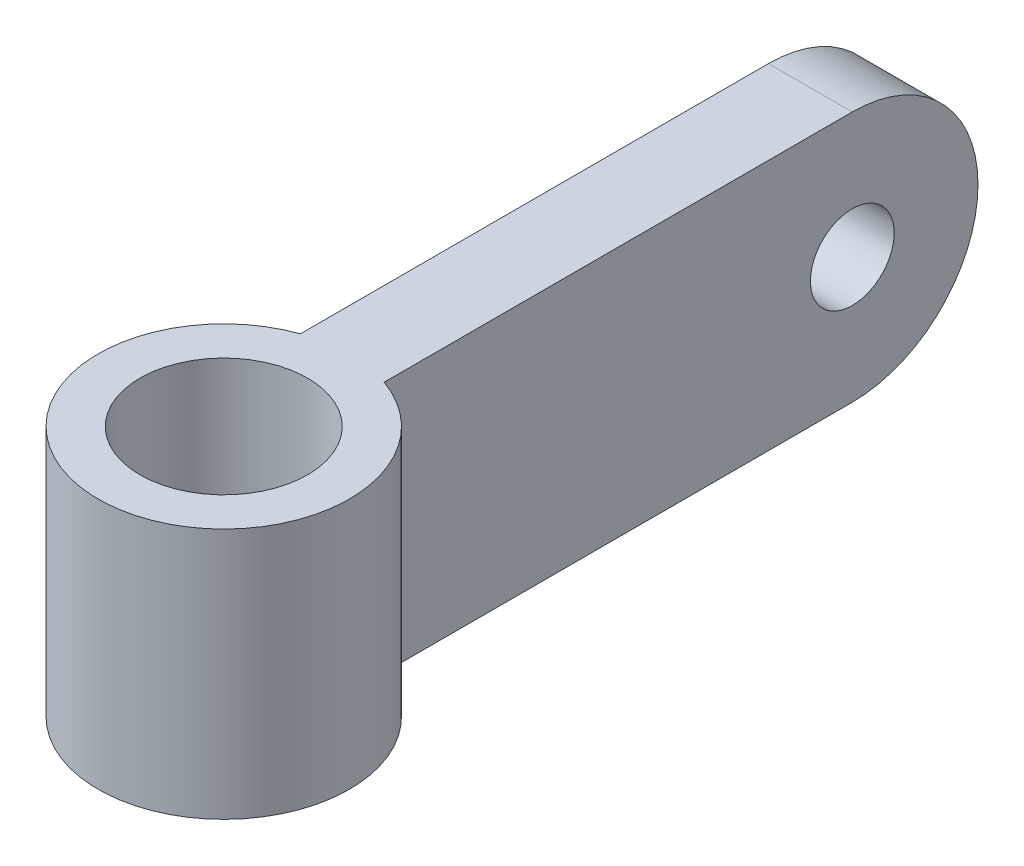
from build123d import *

# Parameters (mm, degrees)
SKETCH_1_R           = 30
SKETCH_1_R_2         = 20
EXTRUDE_1_DEPTH      = 30
SKETCH_2_W           = 140
SKETCH_2_H           = 60
EXTRUDE_2_DEPTH      = 10
SKETCH_3_R           = 10
CUT_EXTRUDE_1_DEPTH  = 178.200451467
FILLET_1_RADIUS      = 30
FILLET_1_LENGTH      = 20
EXTRUDE_3_REACH      = 148.287
EXTRUDE_3_END_RADIUS = 30
SKETCH_4_W           = 20
SKETCH_4_H           = 60


with BuildPart() as part:
    # 草图1 → 凸台-拉伸1 (new, symmetric)
    with BuildSketch(Plane(origin=(0, 0, 0), x_dir=(1, 0, 0), z_dir=(0, 1, 0))):
        with Locations(Location((0, 0, 0), (0, 0, 270))):
            Circle(SKETCH_1_R)
        with Locations(Location((0, 0, 0), (0, 0, 270))):
            Circle(SKETCH_1_R_2, mode=Mode.SUBTRACT)
    extrude(amount=EXTRUDE_1_DEPTH, both=True)



with BuildPart() as body_2:
    # 草图2 → 凸台-拉伸2 (new, symmetric)
    with BuildSketch(Plane(origin=(0, 0, 0), x_dir=(0, 0, -1), z_dir=(1, 0, 0))):
        with Locations((100, 0)):
            Rectangle(SKETCH_2_W, SKETCH_2_H)
    extrude(amount=EXTRUDE_2_DEPTH, both=True)

    # 草图3 → 切除-拉伸1 (cut, through all)
    with BuildSketch(Plane(origin=(10, 0, 0), x_dir=(0, 0, -1), z_dir=(1, 0, 0))):
        with Locations((140, 0)):
            Circle(SKETCH_3_R)
    extrude(amount=-CUT_EXTRUDE_1_DEPTH, mode=Mode.SUBTRACT)

    # 圆角1: full round fillet: the end face becomes a half cylinder, R = half its width
    fillet_1_face = Plane((0, 0, -170), x_dir=(1, 0, 0), z_dir=(0, 0, -1))  # on the end face: x along it, z out of the body
    fillet_1_slab = fillet_1_face.offset(-FILLET_1_RADIUS / 2) * Box(FILLET_1_LENGTH, 2 * FILLET_1_RADIUS, FILLET_1_RADIUS, mode=Mode.PRIVATE)  # the body's end, R deep
    fillet_1_round = Plane((0, 0, -140), x_dir=(0, 0, -1), z_dir=(1, 0, 0)) * Cylinder(FILLET_1_RADIUS, FILLET_1_LENGTH, mode=Mode.PRIVATE)  # its axis R under the face
    add(fillet_1_slab - fillet_1_round, mode=Mode.SUBTRACT)


with BuildPart() as part_1:
    add(part.part)

    add(body_2.part)  # 凸台-拉伸3 merges body 2
    # 凸台-拉伸3: up to this cylinder (the profile starts outside it)
    extrude_3_end = Plane(origin=(0, 0, 0), z_dir=(0, -1, 0)) * Cylinder(EXTRUDE_3_END_RADIUS, 357.574, mode=Mode.PRIVATE)
    # 草图4 → 凸台-拉伸3 (add, up to the surface)
    with BuildSketch(Plane.XY.offset(-30), mode=Mode.PRIVATE) as extrude_3_sk1:
        Rectangle(SKETCH_4_W, SKETCH_4_H)
    extrude_3_tool1 = extrude(extrude_3_sk1.sketch, amount=EXTRUDE_3_REACH, mode=Mode.PRIVATE) - extrude_3_end
    add(extrude_3_tool1.solids().sort_by_distance((0, 0, -30))[0])
    add(extrude_3_tool1.solids().sort_by_distance((0, 0, -30))[1])


solid = part_1.part
